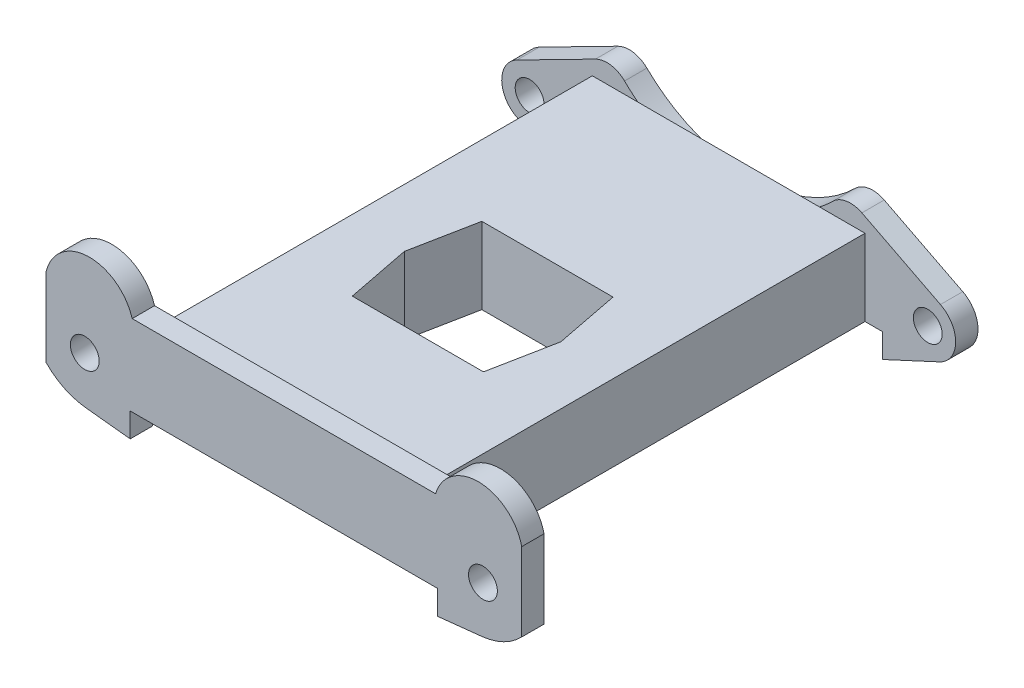
from build123d import *

# Parameters (mm, degrees)
SKETCH1_W           = 37.211
SKETCH1_H           = 57.658
BOSS_EXTRUDE1_DEPTH = 10.4394
BOSS_EXTRUDE2_DEPTH = 3.048
BOSS_EXTRUDE3_DEPTH = 3.048
SKETCH5_R           = 1.9685
CUT_EXTRUDE1_DEPTH  = 74.180460976
SKETCH6_R           = 1.9685
CUT_EXTRUDE2_DEPTH  = 5.08


with BuildPart() as part:
    # Sketch1 → Boss-Extrude1 (new body)
    with BuildSketch(Plane(origin=(0, 0, 0), x_dir=(1, 0, 0), z_dir=(0, 1, 0))):
        Rectangle(SKETCH1_W, SKETCH1_H)
        Polygon((-8.949851054, 4.0894), (8.949851054, 4.0894), (10.6807, -4.7498), (8.949851054, -13.589), (-8.949851054, -13.589), (-10.6807, -4.7498), align=None, mode=Mode.SUBTRACT)
    extrude(amount=BOSS_EXTRUDE1_DEPTH)

    # Sketch2 → Boss-Extrude2 (add)
    with BuildSketch(Plane.XY.offset(28.829)):
        with BuildLine():
            Line((-20.701, 11.049), (20.701, 11.049))
            ThreePointArc((20.701, 11.049), (26.723405801, 15.394332642), (32.4612, 10.679568052))
            Line((32.4612, 10.679568052), (32.4612, 0))
            ThreePointArc((32.4612, 0), (29.989172762, -1.802849379), (27.049629295, -2.651535867))
            Line((27.049629295, -2.651535867), (20.9677, -3.302))
            Line((20.9677, -3.302), (20.9677, 0))
            Line((20.9677, 0), (-20.9677, 0))
            Line((-20.9677, 0), (-20.9677, -3.302))
            Line((-20.9677, -3.302), (-27.049629295, -2.651535867))
            ThreePointArc((-27.049629295, -2.651535867), (-29.989172762, -1.802849379), (-32.4612, 0))
            Line((-32.4612, 0), (-32.4612, 10.679568052))
            ThreePointArc((-32.4612, 10.679568052), (-26.723405801, 15.394332642), (-20.701, 11.049))
        make_face()
    extrude(amount=BOSS_EXTRUDE2_DEPTH)

    # Sketch3 → Boss-Extrude3 (add)
    with BuildSketch(Plane(origin=(0, 0, -28.829), x_dir=(-1, 0, 0), z_dir=(0, 0, -1))):
        with BuildLine():
            Line((18.175030658, 12.62989205), (28.898610874, 7.159054501))
            ThreePointArc((28.898610874, 7.159054501), (30.974624731, 3.696565568), (28.769674487, 0.314723233))
            Line((28.769674487, 0.314723233), (20.9677, -3.302))
            Line((20.9677, -3.302), (20.9677, 0))
            Line((20.9677, 0), (0, 0))
            Line((0, 0), (-20.9677, 0))
            Line((-20.9677, 0), (-20.9677, -3.302))
            Line((-20.9677, -3.302), (-28.769674487, 0.314723233))
            ThreePointArc((-28.769674487, 0.314723233), (-30.974624731, 3.696565568), (-28.898610874, 7.159054501))
            Line((-28.898610874, 7.159054501), (-18.175030658, 12.62989205))
            ThreePointArc((-18.175030658, 12.62989205), (-16.096634608, 12.965404658), (-14.213319827, 12.024434793))
            ThreePointArc((-14.213319827, 12.024434793), (0, 6.223), (14.213319827, 12.024434793))
            ThreePointArc((14.213319827, 12.024434793), (16.096634608, 12.965404658), (18.175030658, 12.62989205))
        make_face()
    extrude(amount=BOSS_EXTRUDE3_DEPTH)

    # Sketch5 → Cut-Extrude1 (cut, through all)
    with BuildSketch(Plane(origin=(0, 0, -31.877), x_dir=(-1, 0, 0), z_dir=(0, 0, -1))):
        with Locations((-27.16873413, 3.768262533)):
            Circle(SKETCH5_R)
        with Locations((27.16873413, 3.768262533)):
            Circle(SKETCH5_R)
    extrude(amount=-CUT_EXTRUDE1_DEPTH, mode=Mode.SUBTRACT)

    # Sketch6 → Cut-Extrude2 (cut)
    with BuildSketch(Plane.XZ):
        with Locations(Location((-10.0076, 24.6507, 0), (0, 0, 270))):
            Circle(SKETCH6_R)
        with Locations(Location((10.0076, 24.6507, 0), (0, 0, 270))):
            Circle(SKETCH6_R)
        with Locations(Location((-10.0076, -16.1417, 0), (0, 0, 270))):
            Circle(SKETCH6_R)
        with Locations(Location((10.0076, -16.1417, 0), (0, 0, 270))):
            Circle(SKETCH6_R)
    extrude(amount=-CUT_EXTRUDE2_DEPTH, mode=Mode.SUBTRACT)


solid = part.part
